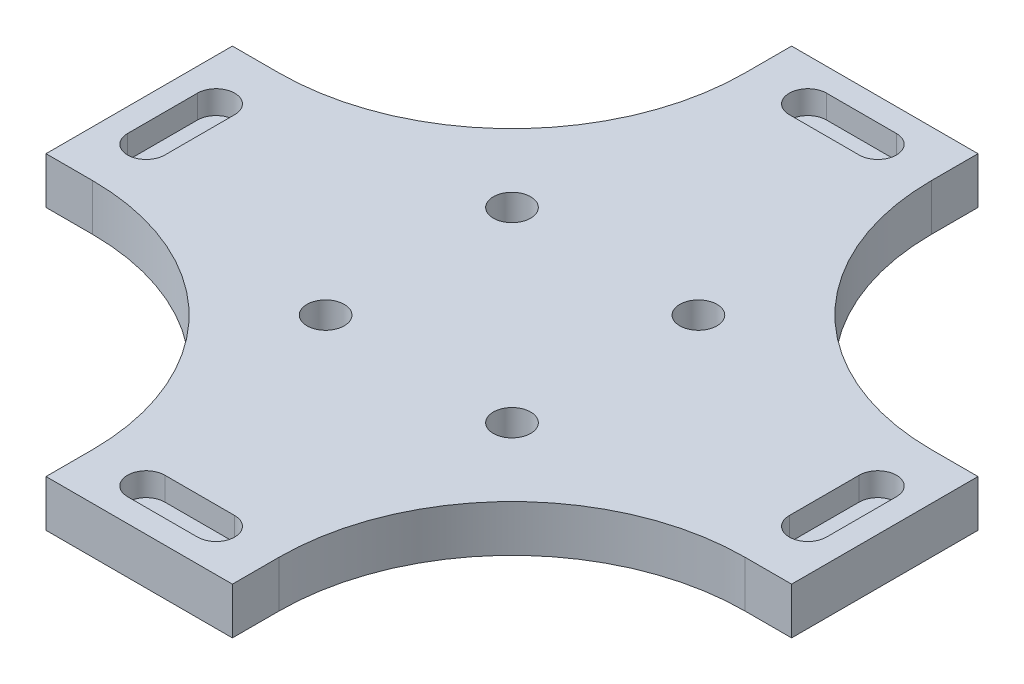
from build123d import *

# Parameters (mm, degrees)
SKETCH1_R           = 2
BOSS_EXTRUDE1_DEPTH = 5
SKETCH2_W           = 4.72967701
SKETCH2_H           = 13.394822952
SKETCH2_W_2         = 13.394822952
SKETCH2_H_2         = 4.72967701
SKETCH2_W_3         = 4.729677011
BOSS_EXTRUDE2_DEPTH = 2.5


with BuildPart() as part:
    # Sketch1 → Boss-Extrude1 (new body)
    with BuildSketch(Plane(origin=(0, 0, 0), x_dir=(1, 0, 0), z_dir=(0, 1, 0))):
        with BuildLine():
            Line((-7.172850367, 15.825076528), (-7.172850367, 20.825076528))
            Line((-7.172850367, 20.825076528), (12.827149633, 20.825076528))
            Line((12.827149633, 20.825076528), (12.827149633, 15.825076528))
            ThreePointArc((12.827149633, 15.825076528), (20.149480103, -1.852593001), (37.827149633, -9.174923472))
            Line((37.827149633, -9.174923472), (42.827149633, -9.174923472))
            Line((42.827149633, -9.174923472), (42.827149633, -29.174923472))
            Line((42.827149633, -29.174923472), (37.827149633, -29.174923472))
            ThreePointArc((37.827149633, -29.174923472), (20.149480103, -36.497253942), (12.827149633, -54.174923472))
            Line((12.827149633, -54.174923472), (12.827149633, -59.174923472))
            Line((12.827149633, -59.174923472), (-7.172850367, -59.174923472))
            Line((-7.172850367, -59.174923472), (-7.172850367, -54.174923472))
            ThreePointArc((-7.172850367, -54.174923472), (-14.495180838, -36.497253942), (-32.172850367, -29.174923472))
            Line((-32.172850367, -29.174923472), (-37.172850367, -29.174923472))
            Line((-37.172850367, -29.174923472), (-37.172850367, -9.174923472))
            Line((-37.172850367, -9.174923472), (-32.172850367, -9.174923472))
            ThreePointArc((-32.172850367, -9.174923472), (-14.495180838, -1.852593001), (-7.172850367, 15.825076528))
        make_face()
        with Locations(Location((-7.172850367, -9.174923472, 0), (0, 0, 270))):
            Circle(SKETCH1_R, mode=Mode.SUBTRACT)
        with Locations(Location((12.827149633, -9.174923472, 0), (0, 0, 270))):
            Circle(SKETCH1_R, mode=Mode.SUBTRACT)
        with Locations(Location((12.827149633, -29.174923472, 0), (0, 0, 270))):
            Circle(SKETCH1_R, mode=Mode.SUBTRACT)
        with Locations(Location((-7.172850367, -29.174923472, 0), (0, 0, 270))):
            Circle(SKETCH1_R, mode=Mode.SUBTRACT)
        with BuildLine():
            Line((-0.922850367, 18.325076528), (6.577149633, 18.325076528))
            ThreePointArc((6.577149633, 18.325076528), (8.577149633, 16.325076528), (6.577149633, 14.325076528))
            Line((6.577149633, 14.325076528), (-0.922850367, 14.325076528))
            ThreePointArc((-0.922850367, 14.325076528), (-2.922850367, 16.325076528), (-0.922850367, 18.325076528))
        make_face(mode=Mode.SUBTRACT)
        with BuildLine():
            Line((36.327149633, -15.424923472), (36.327149633, -22.924923472))
            ThreePointArc((36.327149633, -22.924923472), (38.327149633, -24.924923472), (40.327149633, -22.924923472))
            Line((40.327149633, -22.924923472), (40.327149633, -15.424923472))
            ThreePointArc((40.327149633, -15.424923472), (38.327149633, -13.424923472), (36.327149633, -15.424923472))
        make_face(mode=Mode.SUBTRACT)
        with BuildLine():
            Line((6.577149633, -52.674923472), (-0.922850367, -52.674923472))
            ThreePointArc((-0.922850367, -52.674923472), (-2.922850367, -54.674923472), (-0.922850367, -56.674923472))
            Line((-0.922850367, -56.674923472), (6.577149633, -56.674923472))
            ThreePointArc((6.577149633, -56.674923472), (8.577149633, -54.674923472), (6.577149633, -52.674923472))
        make_face(mode=Mode.SUBTRACT)
        with BuildLine():
            Line((-30.672850367, -22.924923472), (-30.672850367, -15.424923472))
            ThreePointArc((-30.672850367, -15.424923472), (-32.672850367, -13.424923472), (-34.672850367, -15.424923472))
            Line((-34.672850367, -15.424923472), (-34.672850367, -22.924923472))
            ThreePointArc((-34.672850367, -22.924923472), (-32.672850367, -24.924923472), (-30.672850367, -22.924923472))
        make_face(mode=Mode.SUBTRACT)
    extrude(amount=BOSS_EXTRUDE1_DEPTH)

    # Sketch2 → Boss-Extrude2 (add)
    with BuildSketch(Plane.XZ):
        with Locations((38.392291652, 19.174923472)):
            Rectangle(SKETCH2_W, SKETCH2_H)
        with Locations((2.827149633, 54.740065491)):
            Rectangle(SKETCH2_W_2, SKETCH2_H_2)
        with Locations((2.827149633, -16.390218547)):
            Rectangle(SKETCH2_W_2, SKETCH2_H_2)
        with Locations((-32.737992386, 19.174923472)):
            Rectangle(SKETCH2_W_3, SKETCH2_H)
    extrude(amount=-BOSS_EXTRUDE2_DEPTH)


solid = part.part
